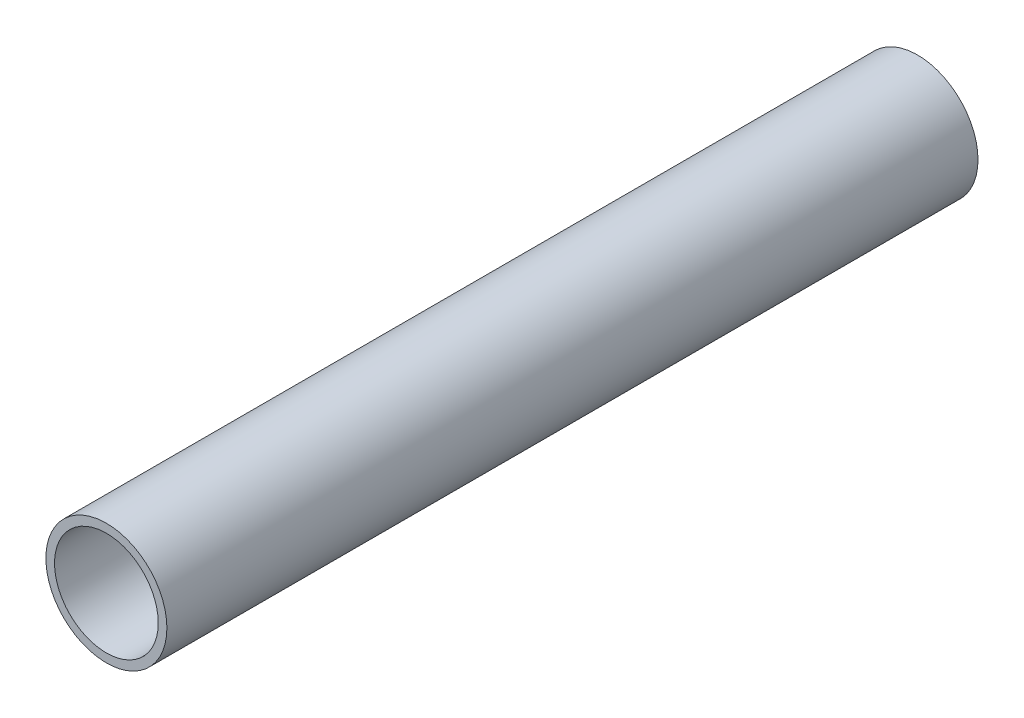
from build123d import *

# Parameters (mm, degrees)
SKETCH1_R           = 11.1125
SKETCH1_R_2         = 9.525
BOSS_EXTRUDE1_DEPTH = 74.4855


with BuildPart() as part:
    # Sketch1 → Boss-Extrude1 (new, symmetric)
    with BuildSketch(Plane.XY):
        Circle(SKETCH1_R)
        Circle(SKETCH1_R_2, mode=Mode.SUBTRACT)
    extrude(amount=BOSS_EXTRUDE1_DEPTH, both=True)


solid = part.part
